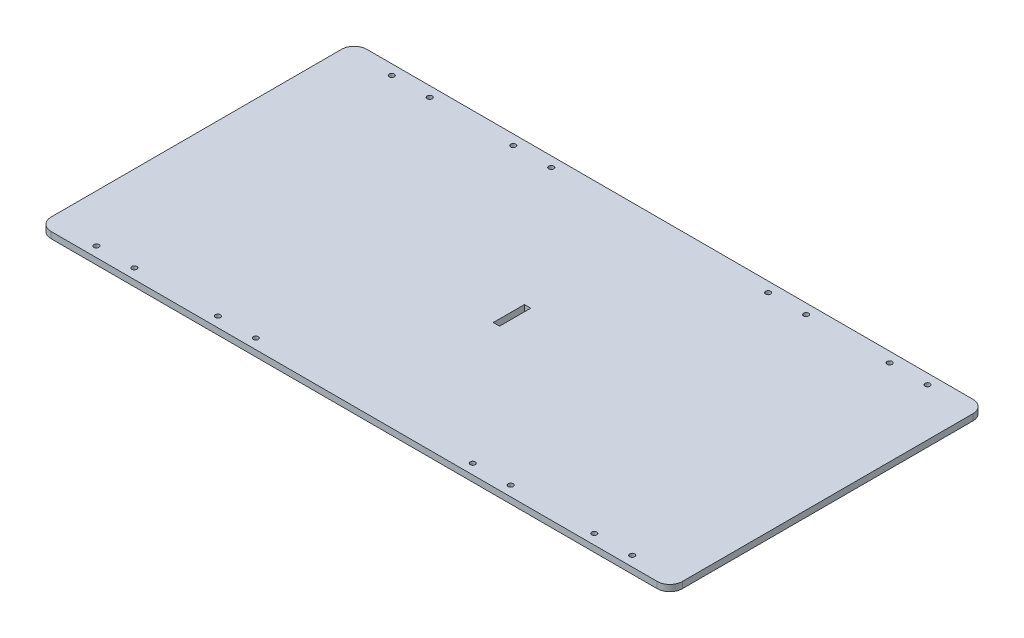
from build123d import *

# Parameters (mm, degrees)
SALIENTE_EXTRUIR1_DEPTH = 5
CROQUIS2_R              = 2
CORTAR_EXTRUIR1_DEPTH   = 10
CROQUIS3_W              = 5
CROQUIS3_H              = 24.74
CORTAR_EXTRUIR2_DEPTH   = 10


with BuildPart() as part:
    # Croquis1 → Saliente-Extruir1 (new body)
    with BuildSketch(Plane(origin=(0, 0, 0), x_dir=(1, 0, 0), z_dir=(0, 1, 0))):
        with BuildLine():
            Line((240, -125), (-240, -125))
            ThreePointArc((-240, -125), (-247.071067812, -122.071067812), (-250, -115))
            Line((-250, -115), (-250, 115))
            ThreePointArc((-250, 115), (-247.071067812, 122.071067812), (-240, 125))
            Line((-240, 125), (240, 125))
            ThreePointArc((240, 125), (247.071067812, 122.071067812), (250, 115))
            Line((250, 115), (250, -115))
            ThreePointArc((250, -115), (247.071067812, -122.071067812), (240, -125))
        make_face()
    extrude(amount=SALIENTE_EXTRUIR1_DEPTH)

    # Croquis2 → Cortar-Extruir1 (cut)
    with BuildSketch(Plane(origin=(0, 5, 0), x_dir=(1, 0, 0), z_dir=(0, 1, 0))):
        with Locations(Location((-212.2, -116.98, 0), (0, 0, 270))):
            Circle(CROQUIS2_R)
        with Locations(Location((-182.15, -116.98, 0), (0, 0, 270))):
            Circle(CROQUIS2_R)
        with Locations(Location((-85.9, -116.98, 0), (0, 0, 270))):
            Circle(CROQUIS2_R)
        with Locations(Location((-115.95, -116.98, 0), (0, 0, 270))):
            Circle(CROQUIS2_R)
        with Locations(Location((212.2, -116.98, 0), (0, 0, 270))):
            Circle(CROQUIS2_R)
        with Locations(Location((182.15, -116.98, 0), (0, 0, 270))):
            Circle(CROQUIS2_R)
        with Locations(Location((115.95, -116.98, 0), (0, 0, 270))):
            Circle(CROQUIS2_R)
        with Locations(Location((85.9, -116.98, 0), (0, 0, 270))):
            Circle(CROQUIS2_R)
        with Locations(Location((212.2, 116.98, 0), (0, 0, 270))):
            Circle(CROQUIS2_R)
        with Locations(Location((182.15, 116.98, 0), (0, 0, 270))):
            Circle(CROQUIS2_R)
        with Locations(Location((115.95, 116.98, 0), (0, 0, 270))):
            Circle(CROQUIS2_R)
        with Locations(Location((85.9, 116.98, 0), (0, 0, 270))):
            Circle(CROQUIS2_R)
        with Locations(Location((-182.15, 116.98, 0), (0, 0, 270))):
            Circle(CROQUIS2_R)
        with Locations(Location((-212.2, 116.98, 0), (0, 0, 270))):
            Circle(CROQUIS2_R)
        with Locations(Location((-85.9, 116.98, 0), (0, 0, 270))):
            Circle(CROQUIS2_R)
        with Locations(Location((-115.95, 116.98, 0), (0, 0, 270))):
            Circle(CROQUIS2_R)
    extrude(amount=-CORTAR_EXTRUIR1_DEPTH, mode=Mode.SUBTRACT)

    # Croquis3 → Cortar-Extruir2 (cut)
    with BuildSketch(Plane(origin=(0, 5, 0), x_dir=(1, 0, 0), z_dir=(0, 1, 0))):
        Rectangle(CROQUIS3_W, CROQUIS3_H)
    extrude(amount=-CORTAR_EXTRUIR2_DEPTH, mode=Mode.SUBTRACT)


solid = part.part
